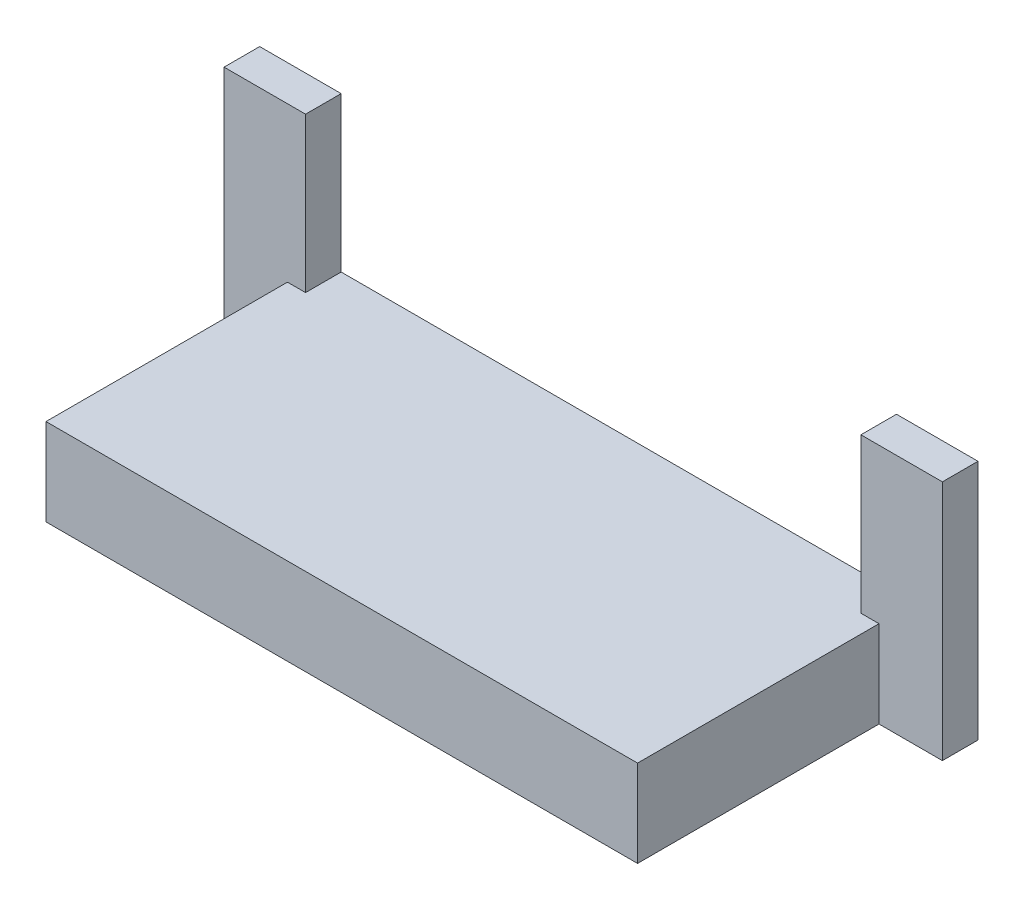
from build123d import *

# Parameters (mm, degrees)
BOSS_EXTRUDE1_DEPTH = 1.475
BOSS_EXTRUDE2_DEPTH = 20


with BuildPart() as part:
    # Sketch1 → Boss-Extrude1 (new, symmetric)
    with BuildSketch(Plane.XY):
        Polygon((-29.75, 10), (-23, 10), (-23, -1.3), (-23, -2.8), (23, -2.8), (23, -1.3), (23, 10), (29.75, 10), (29.75, -10), (-29.75, -10), align=None)
    extrude(amount=BOSS_EXTRUDE1_DEPTH, both=True)

    # Sketch2 → Boss-Extrude2 (add)
    with BuildSketch(Plane.XY.offset(1.475)):
        Polygon((-23, -2.8), (23, -2.8), (24.5, -2.8), (24.5, -10), (23, -10), (-23, -10), (-24.5, -10), (-24.5, -2.8), align=None)
    extrude(amount=BOSS_EXTRUDE2_DEPTH)


solid = part.part
